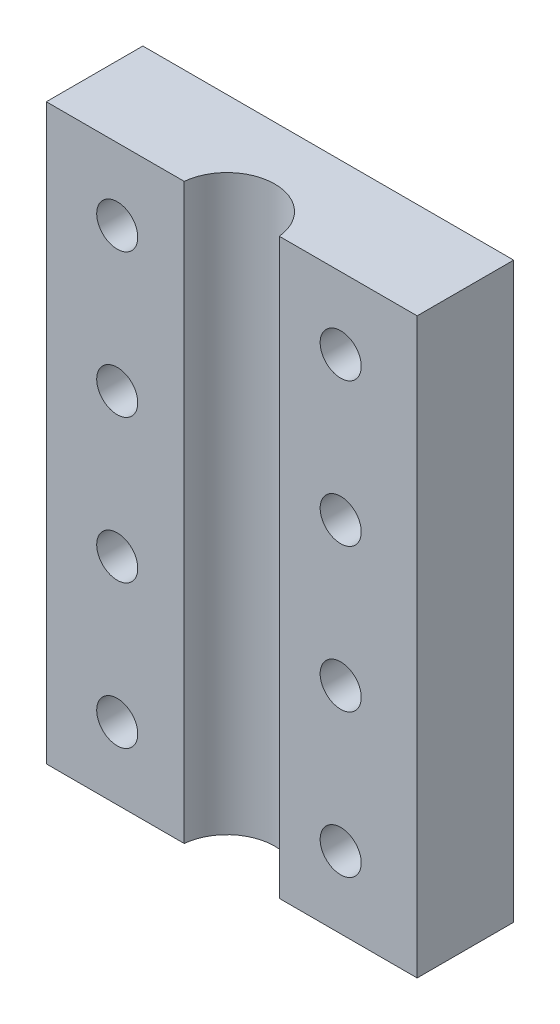
from build123d import *

# Parameters (mm, degrees)
SKETCH_1_W          = 38.8
SKETCH_1_H          = 10.1
EXTRUDE_1_DEPTH     = 60
SKETCH_2_R          = 5
CUT_EXTRUDE_1_DEPTH = 60
SKETCH_3_R          = 2.15
CUT_EXTRUDE_2_DEPTH = 64.862117096


with BuildPart() as part:
    # 草图1 → 凸台-拉伸1 (new body)
    with BuildSketch(Plane(origin=(0, 0, 0), x_dir=(1, 0, 0), z_dir=(0, 1, 0))):
        with Locations((0, 5.05)):
            Rectangle(SKETCH_1_W, SKETCH_1_H)
    extrude(amount=EXTRUDE_1_DEPTH)

    # 草图2 → 切除-拉伸1 (cut)
    with BuildSketch(Plane(origin=(0, 60, 0), x_dir=(1, 0, 0), z_dir=(0, 1, 0))):
        with Locations((0, -0.5)):
            Circle(SKETCH_2_R)
    extrude(amount=-CUT_EXTRUDE_1_DEPTH, mode=Mode.SUBTRACT)

    # 草图3 → 切除-拉伸2 (cut, through all)
    with BuildSketch(Plane(origin=(0, 0, -10.1), x_dir=(-1, 0, 0), z_dir=(0, 0, -1))):
        with Locations((-11.4, 52.5)):
            Circle(SKETCH_3_R)
        with Locations((-11.4, 37.5)):
            Circle(SKETCH_3_R)
        with Locations((-11.4, 22.5)):
            Circle(SKETCH_3_R)
        with Locations((-11.4, 7.5)):
            Circle(SKETCH_3_R)
        with Locations((11.98, 52.5)):
            Circle(SKETCH_3_R)
        with Locations((11.98, 37.5)):
            Circle(SKETCH_3_R)
        with Locations((11.98, 22.5)):
            Circle(SKETCH_3_R)
        with Locations((11.98, 7.5)):
            Circle(SKETCH_3_R)
    extrude(amount=-CUT_EXTRUDE_2_DEPTH, mode=Mode.SUBTRACT)


solid = part.part
